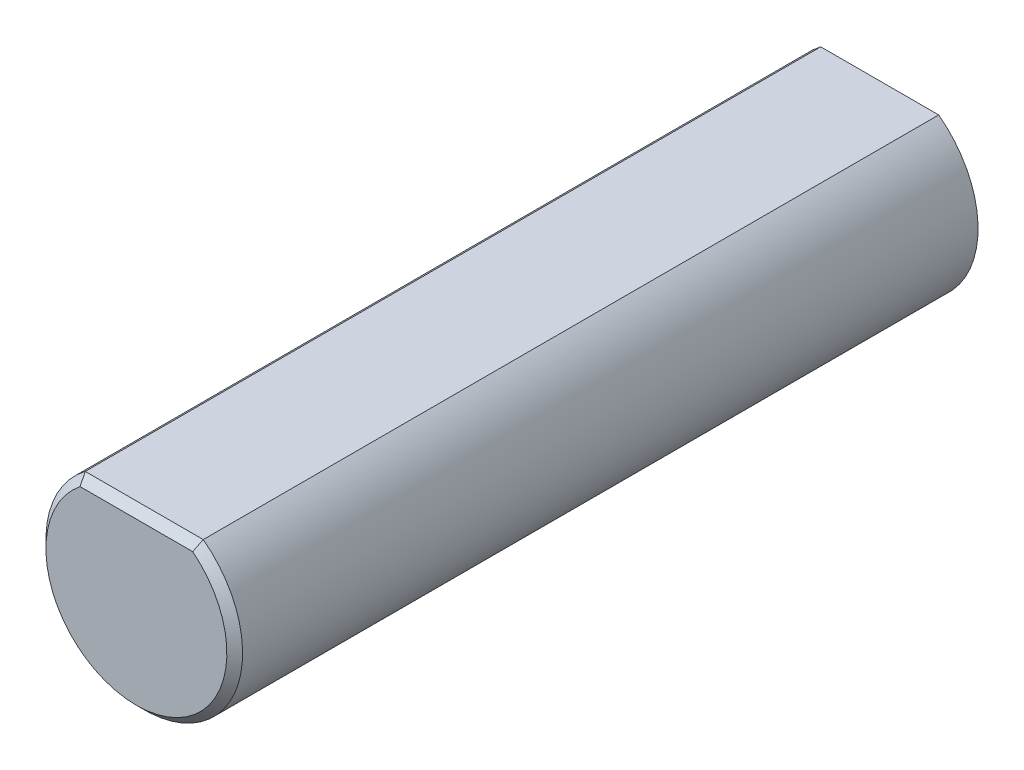
from build123d import *

# Parameters (mm, degrees)
BOSS_EXTRUDE1_DEPTH = 12
CHAMFER1_SIZE       = 0.254


with BuildPart() as part:
    # Sketch1 → Boss-Extrude1 (new, symmetric)
    with BuildSketch(Plane.XY):
        with BuildLine():
            Line((1.905, 2.54), (-1.905, 2.54))
            ThreePointArc((-1.905, 2.54), (0, -3.175), (1.905, 2.54))
        make_face()
    extrude(amount=BOSS_EXTRUDE1_DEPTH, both=True)

    # Chamfer1
    chamfer1_edges = [part.edges().sort_by_distance(p)[0] for p in [
        (0, -3.175, 12),
        (0, 2.54, 12),
    ]]
    chamfer(chamfer1_edges, length=CHAMFER1_SIZE)


solid = part.part
